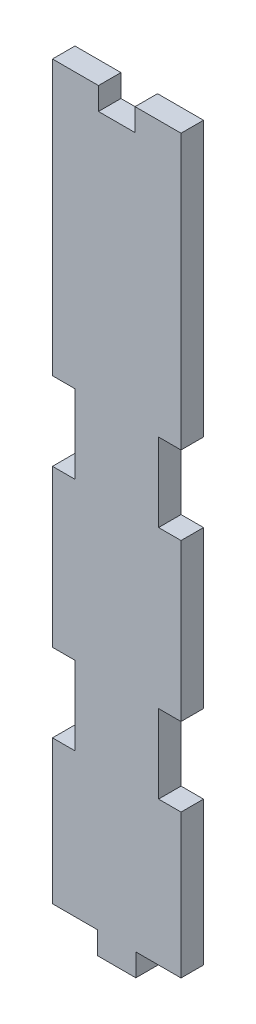
from build123d import *

# Parameters (mm, degrees)
BOSS_EXTRUDE1_DEPTH = 4.3


with BuildPart() as part:
    # Sketch1 → Boss-Extrude1 (new body)
    with BuildSketch(Plane.XY):
        Polygon((3.5, 70), (12.3, 70), (12.3, 17.5), (8, 17.5), (8, 2.5), (12.3, 2.5), (12.3, -27.5), (8, -27.5), (8, -42.5), (12.3, -42.5), (12.3, -70), (3.65, -70), (3.65, -74.3), (-3.65, -74.3), (-3.65, -70), (-12.3, -70), (-12.3, -42.5), (-8, -42.5), (-8, -27.5), (-12.3, -27.5), (-12.3, 2.5), (-8, 2.5), (-8, 17.5), (-12.3, 17.5), (-12.3, 70), (-3.5, 70), (-3.5, 65.7), (3.5, 65.7), align=None)
    extrude(amount=BOSS_EXTRUDE1_DEPTH)


solid = part.part
